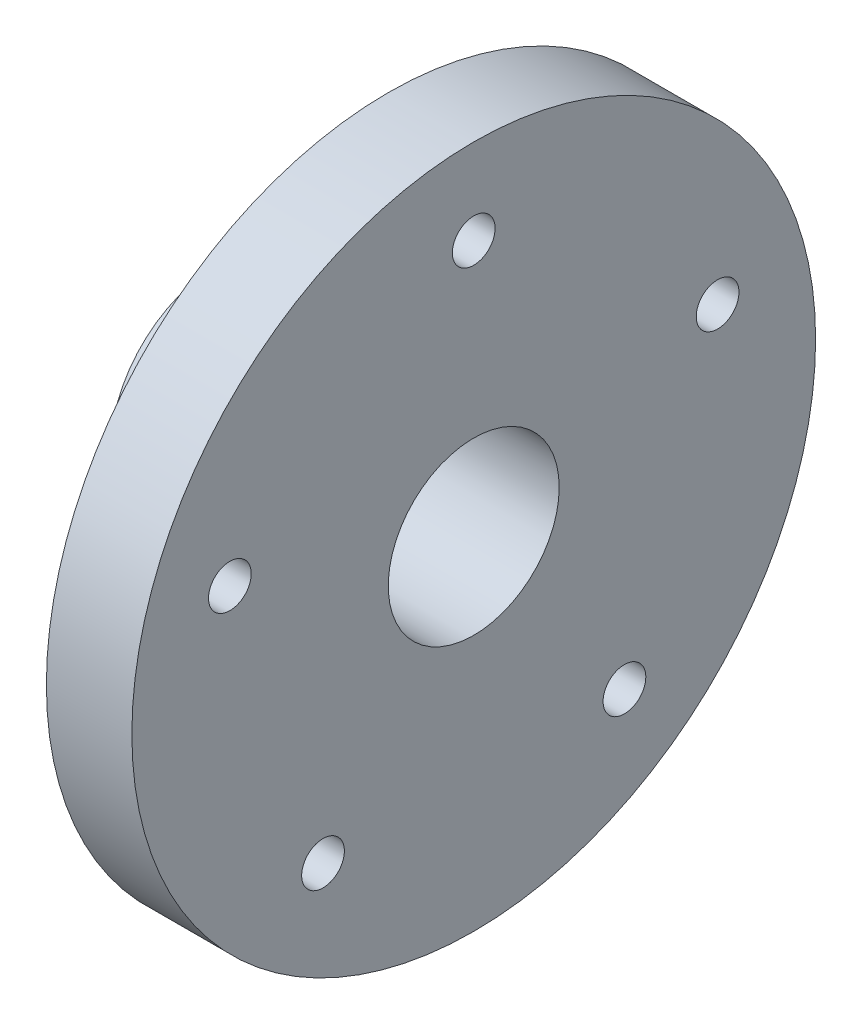
from build123d import *

# Parameters (mm, degrees)
SKETCH2_R           = 4
BOSS_EXTRUDE1_DEPTH = 1
SKETCH4_R           = 1
CUT_EXTRUDE1_DEPTH  = 2.5
SKETCH6_R           = 1.25
SKETCH6_R_2         = 1
BOSS_EXTRUDE4_DEPTH = 2
SKETCH5_R           = 0.25
CUT_EXTRUDE2_DEPTH  = 2
CIRPATTERN1_COUNT   = 5


with BuildPart() as part:
    # Sketch2 → Boss-Extrude1 (new body)
    with BuildSketch(Plane(origin=(0, 0, 0), x_dir=(0, 0, -1), z_dir=(1, 0, 0))):
        Circle(SKETCH2_R)
    extrude(amount=-BOSS_EXTRUDE1_DEPTH)

    # Sketch4 → Cut-Extrude1 (cut)
    with BuildSketch(Plane(origin=(0, 0, 0), x_dir=(0, 0, -1), z_dir=(1, 0, 0))):
        Circle(SKETCH4_R)
    extrude(amount=-CUT_EXTRUDE1_DEPTH, mode=Mode.SUBTRACT)

    # Sketch6 → Boss-Extrude4 (add)
    with BuildSketch(Plane.ZY.offset(1)):
        with Locations(Location((0, 0, 0), (0, 0, 180))):
            Circle(SKETCH6_R)
        with Locations(Location((0, 0, 0), (0, 0, 180))):
            Circle(SKETCH6_R_2, mode=Mode.SUBTRACT)
    extrude(amount=BOSS_EXTRUDE4_DEPTH)

    # Sketch5 → Cut-Extrude2 (cut)
    with BuildSketch(Plane(origin=(0, 0, 0), x_dir=(0, 0, -1), z_dir=(1, 0, 0))):
        with Locations((0, 3)):
            Circle(SKETCH5_R)
    cut_extrude2 = extrude(amount=-CUT_EXTRUDE2_DEPTH, mode=Mode.SUBTRACT)

    # CirPattern1: Cut-Extrude2 ×5 about axis
    cirpattern1_axis = Axis((0, 0, 0), (1, 0, 0))
    for i in range(1, CIRPATTERN1_COUNT):
        add(cut_extrude2.rotate(cirpattern1_axis, i * 360 / CIRPATTERN1_COUNT), mode=Mode.SUBTRACT)


solid = part.part
